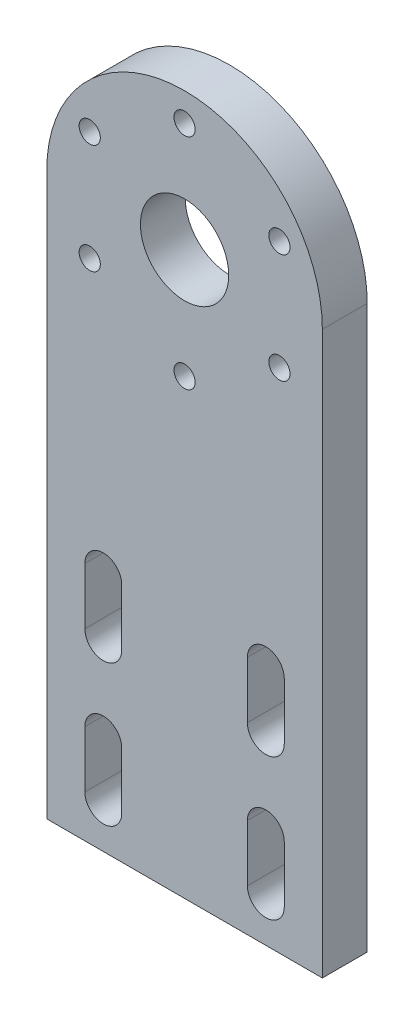
from build123d import *

# Parameters (mm, degrees)
BOSS_EXTRUDE1_DEPTH             = 6.35
CUT_EXTRUDE1_REACH              = 84.103
CUT_EXTRUDE2_REACH              = 84.103
SKETCH3_R                       = 6.25
F_3_0MM_CLEARANCE_DOWEL_HOLE1_D = 3
CIRPATTERN1_COUNT               = 6


with BuildPart() as part:
    # Sketch1 → Boss-Extrude1 (new body)
    with BuildSketch(Plane.XY):
        with BuildLine():
            Line((19.5, 0), (19.5, -79.5))
            Line((19.5, -79.5), (-19.5, -79.5))
            Line((-19.5, -79.5), (-19.5, 0))
            ThreePointArc((-19.5, 0), (0, 19.5), (19.5, 0))
        make_face()
    extrude(amount=BOSS_EXTRUDE1_DEPTH)

    # Sketch2 → Cut-Extrude1 (cut, up to next)
    with BuildSketch(Plane.XY.offset(6.35), mode=Mode.PRIVATE) as cut_extrude1_sk1:
        with BuildLine():
            Line((-14.11, -73.5), (-14.11, -65.5))
            ThreePointArc((-14.11, -65.5), (-11.5, -62.89), (-8.89, -65.5))
            Line((-8.89, -65.5), (-8.89, -73.5))
            ThreePointArc((-8.89, -73.5), (-11.5, -76.11), (-14.11, -73.5))
        make_face()
    cut_extrude1_tool1 = extrude(cut_extrude1_sk1.sketch, amount=-CUT_EXTRUDE1_REACH, mode=Mode.PRIVATE) & part.part
    # Sketch2 → Cut-Extrude1 (cut, up to next)
    with BuildSketch(Plane.XY.offset(6.35), mode=Mode.PRIVATE) as cut_extrude1_sk2:
        with BuildLine():
            Line((-14.11, -53.5), (-14.11, -45.5))
            ThreePointArc((-14.11, -45.5), (-11.5, -42.89), (-8.89, -45.5))
            Line((-8.89, -45.5), (-8.89, -53.5))
            ThreePointArc((-8.89, -53.5), (-11.5, -56.11), (-14.11, -53.5))
        make_face()
    cut_extrude1_tool2 = extrude(cut_extrude1_sk2.sketch, amount=-CUT_EXTRUDE1_REACH, mode=Mode.PRIVATE) & part.part
    # Sketch2 → Cut-Extrude1 (cut, up to next)
    with BuildSketch(Plane.XY.offset(6.35), mode=Mode.PRIVATE) as cut_extrude1_sk3:
        with BuildLine():
            Line((14.11, -73.5), (14.11, -65.5))
            ThreePointArc((14.11, -65.5), (11.5, -62.89), (8.89, -65.5))
            Line((8.89, -65.5), (8.89, -73.5))
            ThreePointArc((8.89, -73.5), (11.5, -76.11), (14.11, -73.5))
        make_face()
    cut_extrude1_tool3 = extrude(cut_extrude1_sk3.sketch, amount=-CUT_EXTRUDE1_REACH, mode=Mode.PRIVATE) & part.part
    # Sketch2 → Cut-Extrude1 (cut, up to next)
    with BuildSketch(Plane.XY.offset(6.35), mode=Mode.PRIVATE) as cut_extrude1_sk4:
        with BuildLine():
            Line((14.11, -53.5), (14.11, -45.5))
            ThreePointArc((14.11, -45.5), (11.5, -42.89), (8.89, -45.5))
            Line((8.89, -45.5), (8.89, -53.5))
            ThreePointArc((8.89, -53.5), (11.5, -56.11), (14.11, -53.5))
        make_face()
    cut_extrude1_tool4 = extrude(cut_extrude1_sk4.sketch, amount=-CUT_EXTRUDE1_REACH, mode=Mode.PRIVATE) & part.part
    add(cut_extrude1_tool1.solids().sort_by_distance((-11.5, -69.5, 6.35))[0], mode=Mode.SUBTRACT)
    add(cut_extrude1_tool2.solids().sort_by_distance((-11.5, -49.5, 6.35))[0], mode=Mode.SUBTRACT)
    add(cut_extrude1_tool3.solids().sort_by_distance((11.5, -69.5, 6.35))[0], mode=Mode.SUBTRACT)
    add(cut_extrude1_tool4.solids().sort_by_distance((11.5, -49.5, 6.35))[0], mode=Mode.SUBTRACT)

    # Sketch3 → Cut-Extrude2 (cut, up to next)
    with BuildSketch(Plane.XY.offset(6.35), mode=Mode.PRIVATE) as cut_extrude2_sk1:
        Circle(SKETCH3_R)
    cut_extrude2_tool1 = extrude(cut_extrude2_sk1.sketch, amount=-CUT_EXTRUDE2_REACH, mode=Mode.PRIVATE) & part.part
    add(cut_extrude2_tool1.solids().sort_by_distance((0, 0, 6.35))[0], mode=Mode.SUBTRACT)

    # Ø3.0mm Clearance Dowel Hole1 (through all)
    with Locations(Plane(origin=(0, 15.5, 6.35), x_dir=(1, 0, 0), z_dir=(0, 0, 1))):
        with Locations((0, 0)):
            f_3_0mm_clearance_dowel_hole1 = Hole(F_3_0MM_CLEARANCE_DOWEL_HOLE1_D / 2)

    # CirPattern1: Ø3.0mm Clearance Dowel Hole1 ×6 about axis
    cirpattern1_axis = Axis((0, 0, 0), (0, 0, 1))
    for i in range(1, CIRPATTERN1_COUNT):
        add(f_3_0mm_clearance_dowel_hole1.rotate(cirpattern1_axis, i * 360 / CIRPATTERN1_COUNT), mode=Mode.SUBTRACT)


solid = part.part
